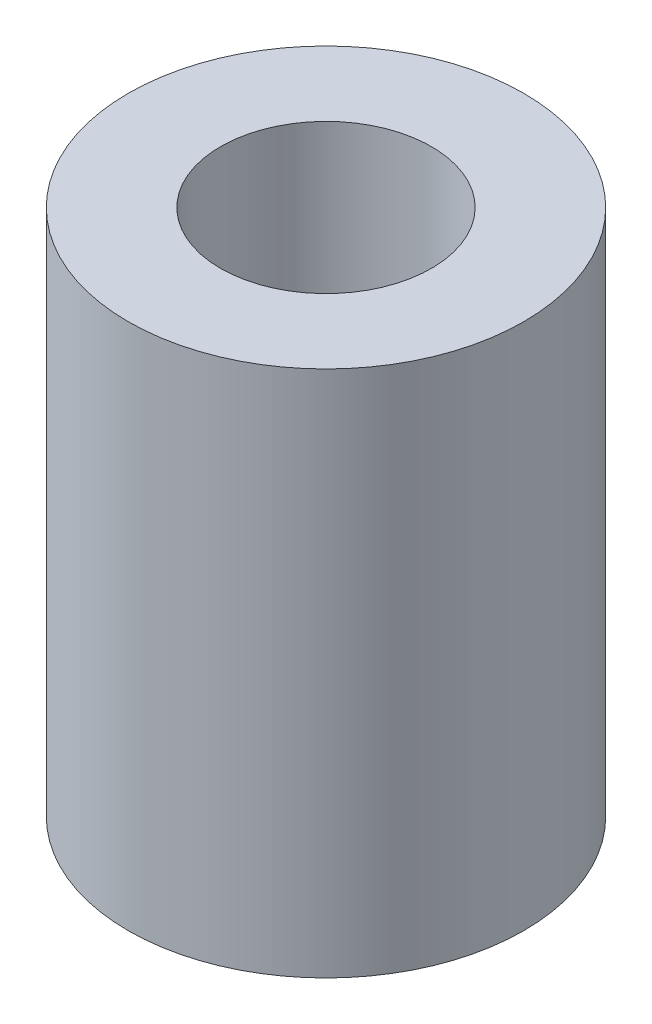
from build123d import *

# Parameters (mm, degrees)
SKETCH_1_R          = 7.5
EXTRUDE_1_DEPTH     = 20
SKETCH_3_R          = 4
CUT_EXTRUDE_1_DEPTH = 21.36


with BuildPart() as part:
    # 스케치1 → 보스-돌출1 (new body)
    with BuildSketch(Plane(origin=(0, 0, 0), x_dir=(1, 0, 0), z_dir=(0, 1, 0))):
        with Locations(Location((0, 0, 0), (0, 0, 270))):
            Circle(SKETCH_1_R)
    extrude(amount=-EXTRUDE_1_DEPTH)

    # 스케치3 → 컷-돌출1 (cut)
    with BuildSketch(Plane(origin=(0, 0, 0), x_dir=(1, 0, 0), z_dir=(0, 1, 0))):
        with Locations(Location((0, 0, 0), (0, 0, 270))):
            Circle(SKETCH_3_R)
    extrude(amount=-CUT_EXTRUDE_1_DEPTH, mode=Mode.SUBTRACT)


solid = part.part
